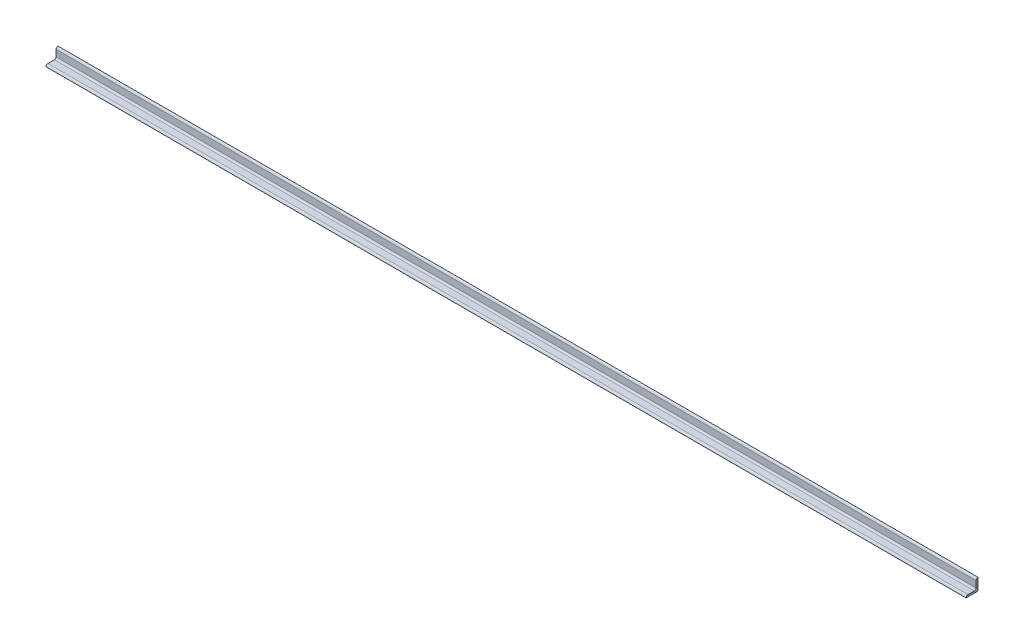
from build123d import *

# Parameters (mm, degrees)
MIEMBRO_ESTRUCTURAL1_DEPTH = 1920


with BuildPart() as part:
    # Sketch1 → Miembro estructural1 (new body)
    with BuildSketch(Plane.YZ.offset(-960)):
        with BuildLine():
            Line((0, 0), (0, 25))
            ThreePointArc((0, 25), (2.828427125, 23.828427125), (4, 21))
            Line((4, 21), (4, 7.5))
            ThreePointArc((4, 7.5), (5.025126266, 5.025126266), (7.5, 4))
            Line((7.5, 4), (21, 4))
            ThreePointArc((21, 4), (23.828427125, 2.828427125), (25, 0))
            Line((25, 0), (0, 0))
        make_face()
    extrude(amount=MIEMBRO_ESTRUCTURAL1_DEPTH)


solid = part.part
